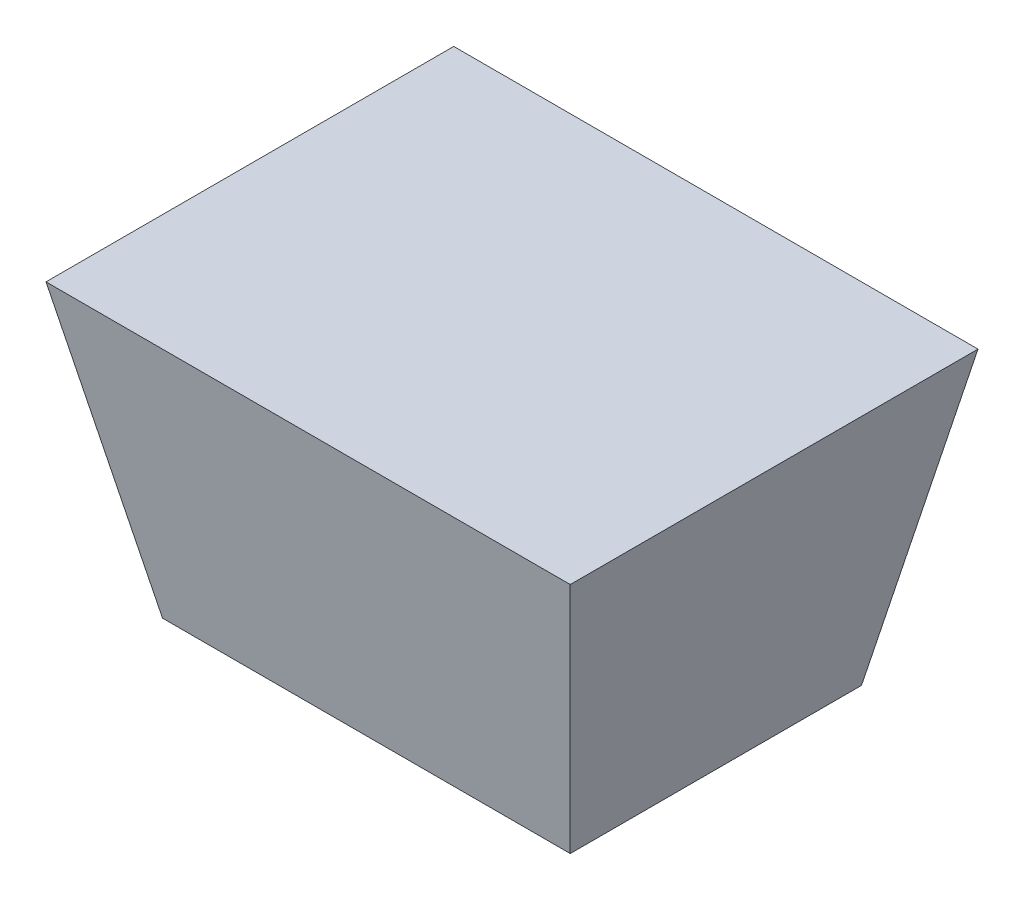
from build123d import *


with BuildPart() as part:
    # Sketch2 → Loft2 section 0
    with BuildSketch(Plane(origin=(0, 50, 0), x_dir=(1, 0, 0), z_dir=(0, 1, 0))):
        with BuildLine():
            Line((-45, 35), (45, 35))
            Line((45, 35), (45, -35))
            Line((45, -35), (-45, -35))
            Line((-45, -35), (-45, 35))
        make_face()
    # Sketch1 → Loft2 section 1
    with BuildSketch(Plane(origin=(0, 0, 0), x_dir=(1, 0, 0), z_dir=(0, 1, 0))):
        with BuildLine():
            Line((-35, 25), (35, 25))
            Line((35, 25), (35, -25))
            Line((35, -25), (-35, -25))
            Line((-35, -25), (-35, 25))
        make_face()
    loft()


solid = part.part
